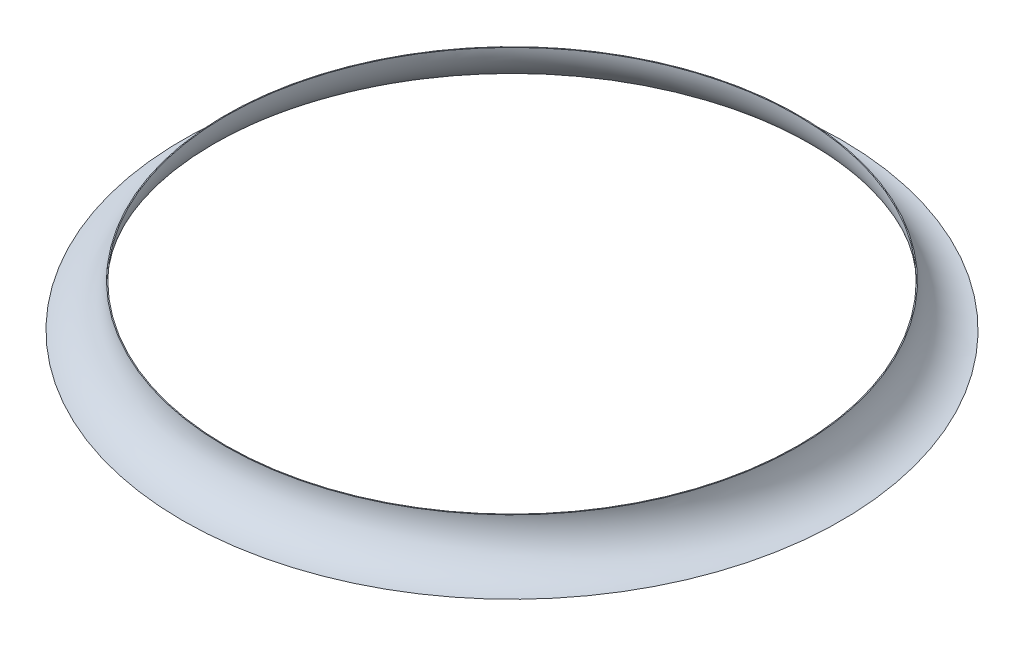
from build123d import *


with BuildPart() as part:
    # Sketch1 → Revolve1 (revolve)
    with BuildSketch(Plane(origin=(0, 0, 0), x_dir=(0, 0, -1), z_dir=(1, 0, 0))):
        with BuildLine():
            Line((-1572.62527351, 13.651366419), (-1575.12527351, 13.651366419))
            ThreePointArc((-1575.12527351, 13.651366419), (-1610.272459768, -71.201447323), (-1695.12527351, -106.348633581))
            Line((-1695.12527351, -106.348633581), (-1670.503129006, -106.348633581))
            ThreePointArc((-1670.503129006, -106.348633581), (-1600.197767745, -63.776139347), (-1572.62527351, 13.651366419))
        make_face()
    revolve(axis=Axis((0, 13.651366419, 772.12527351), (0, -1, 0)))


solid = part.part
